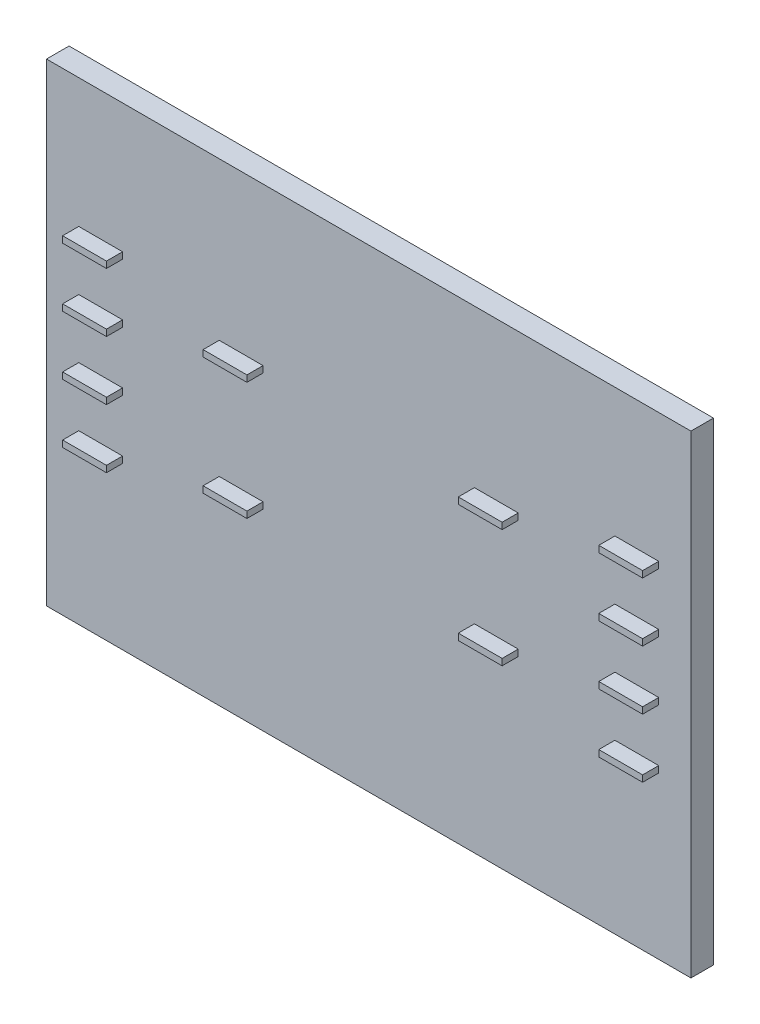
from build123d import *

# Parameters (mm, degrees)
SKETCH1_W           = 200
SKETCH1_H           = 150
BOSS_EXTRUDE1_DEPTH = 7
SKETCH2_W           = 13.6
SKETCH2_H           = 2
BOSS_EXTRUDE2_DEPTH = 5
SKETCH3_W           = 200
SKETCH3_H           = 7
CUT_EXTRUDE1_DEPTH  = 3


with BuildPart() as part:
    # Sketch1 → Boss-Extrude1 (new body)
    with BuildSketch(Plane.XY):
        with Locations((-148.719211823, 89.261083744)):
            Rectangle(SKETCH1_W, SKETCH1_H)
    extrude(amount=BOSS_EXTRUDE1_DEPTH)

    # Sketch2 → Boss-Extrude2 (add)
    with BuildSketch(Plane.XY.offset(7)):
        with Locations((-109.119211823, 114.461083744)):
            Rectangle(SKETCH2_W, SKETCH2_H)
        with Locations((-65.519211823, 104.961083744)):
            Rectangle(SKETCH2_W, SKETCH2_H)
        with Locations((-65.519211823, 123.261083744)):
            Rectangle(SKETCH2_W, SKETCH2_H)
        with Locations((-65.519211823, 86.661083744)):
            Rectangle(SKETCH2_W, SKETCH2_H)
        with Locations((-65.519211823, 68.361083744)):
            Rectangle(SKETCH2_W, SKETCH2_H)
        with Locations((-231.919211823, 104.961083744)):
            Rectangle(SKETCH2_W, SKETCH2_H)
        with Locations((-231.919211823, 123.261083744)):
            Rectangle(SKETCH2_W, SKETCH2_H)
        with Locations((-231.919211823, 86.661083744)):
            Rectangle(SKETCH2_W, SKETCH2_H)
        with Locations((-231.919211823, 68.361083744)):
            Rectangle(SKETCH2_W, SKETCH2_H)
        with Locations((-188.319211823, 114.461083744)):
            Rectangle(SKETCH2_W, SKETCH2_H)
        with Locations((-188.319211823, 77.861083744)):
            Rectangle(SKETCH2_W, SKETCH2_H)
        with Locations((-109.119211823, 77.861083744)):
            Rectangle(SKETCH2_W, SKETCH2_H)
    extrude(amount=BOSS_EXTRUDE2_DEPTH)

    # Sketch3 → Cut-Extrude1 (cut)
    with BuildSketch(Plane.XZ.offset(-14.261083744)):
        with Locations((-148.719211823, 3.5)):
            Rectangle(SKETCH3_W, SKETCH3_H)
    extrude(amount=-CUT_EXTRUDE1_DEPTH, mode=Mode.SUBTRACT)


solid = part.part
